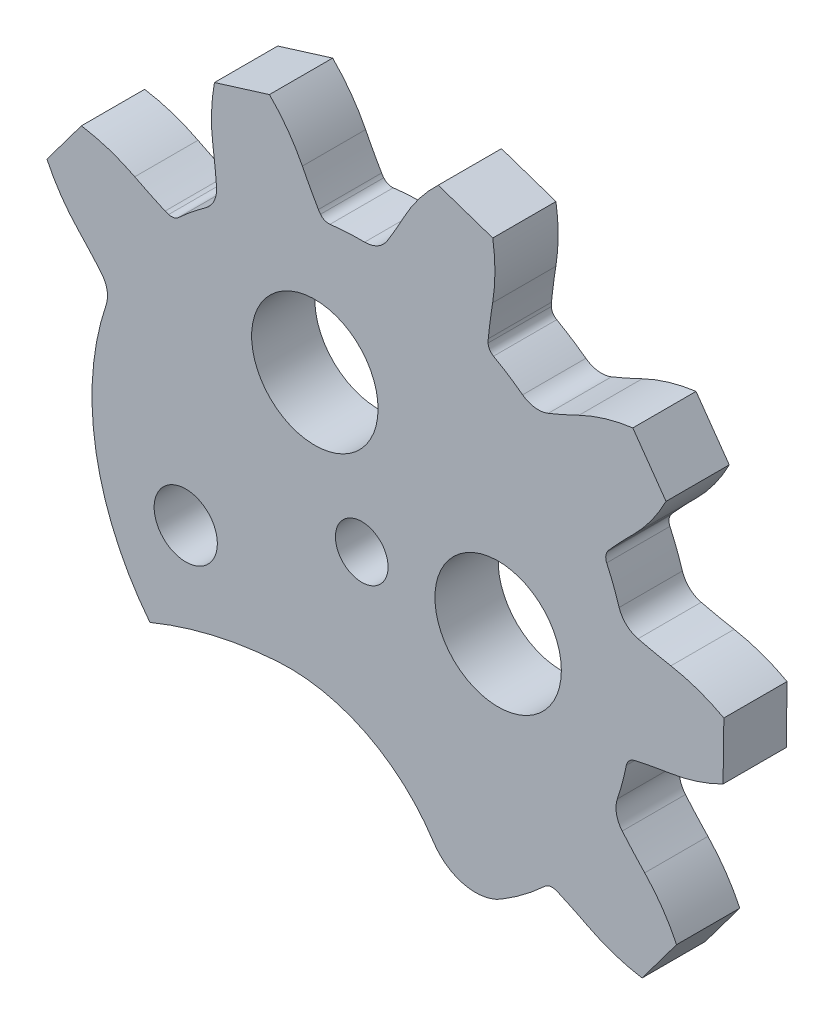
from build123d import *

# Parameters (mm, degrees)
ESQUISSE1_R        = 1.25
ESQUISSE1_R_2      = 3
ESQUISSE1_R_3      = 1.5
BOSS_EXTRU_1_DEPTH = 3


with BuildPart() as part:
    # Esquisse1 → Boss.-Extru.1 (new body)
    with BuildSketch(Plane.XY):
        with BuildLine():
            Line((1036.168665086, 2163.92668469), (1038.777951956, 2164.735581239))
            ThreePointArc((1038.777951956, 2164.735581239), (1039.645641159, 2163.718776789), (1040.340855862, 2162.577088409))
            ThreePointArc((1040.340855862, 2162.577088409), (1040.710583065, 2161.870292972), (1041.100970281, 2161.174695519))
            ThreePointArc((1041.100970281, 2161.174695519), (1041.148071574, 2161.099838925), (1041.200361208, 2161.028509858))
            ThreePointArc((1041.200361208, 2161.028509858), (1041.401673575, 2160.876243049), (1041.651712938, 2160.841715271))
            ThreePointArc((1041.651712938, 2160.841715271), (1042.472135802, 2160.912263521), (1043.295397124, 2160.929913601))
            ThreePointArc((1043.295397124, 2160.929913601), (1043.910230031, 2161.084508602), (1044.369546036, 2161.521484488))
            ThreePointArc((1044.369546036, 2161.521484488), (1044.778634779, 2162.206250429), (1045.167374464, 2162.902769957))
            ThreePointArc((1045.167374464, 2162.902769957), (1045.893264106, 2164.025204841), (1046.788181642, 2165.01812903))
            Line((1046.788181642, 2165.01812903), (1049.374596526, 2164.138839743))
            ThreePointArc((1049.374596526, 2164.138839743), (1049.478909177, 2162.806212746), (1049.370282093, 2161.473930495))
            ThreePointArc((1049.370282093, 2161.473930495), (1049.25395375, 2160.684800777), (1049.160921717, 2159.892586769))
            ThreePointArc((1049.160921717, 2159.892586769), (1049.155027862, 2159.804341066), (1049.155404891, 2159.715899564))
            ThreePointArc((1049.155404891, 2159.715899564), (1049.228769832, 2159.474384686), (1049.410761007, 2159.299481677))
            ThreePointArc((1049.410761007, 2159.299481677), (1050.115964268, 2158.874323951), (1050.792371125, 2158.404702301))
            ThreePointArc((1050.792371125, 2158.404702301), (1051.380650057, 2158.168382569), (1052.009092492, 2158.251924312))
            ThreePointArc((1052.009092492, 2158.251924312), (1052.742547559, 2158.565455267), (1053.466448477, 2158.900455947))
            ThreePointArc((1053.466448477, 2158.900455947), (1054.713456205, 2159.381857617), (1056.021085895, 2159.65913083))
            Line((1056.021085895, 2159.65913083), (1057.596706215, 2157.42751433))
            ThreePointArc((1057.596706215, 2157.42751433), (1056.897798427, 2156.288083004), (1056.026821411, 2155.274093419))
            ThreePointArc((1056.026821411, 2155.274093419), (1055.468870995, 2154.704050151), (1054.927954788, 2154.117818412))
            ThreePointArc((1054.927954788, 2154.117818412), (1054.871317037, 2154.04989046), (1054.819637448, 2153.97811817))
            ThreePointArc((1054.819637448, 2153.97811817), (1054.73703205, 2153.739605699), (1054.781460594, 2153.491134464))
            ThreePointArc((1054.781460594, 2153.491134464), (1055.102080574, 2152.732666561), (1055.373268538, 2151.955152691))
            ThreePointArc((1055.373268538, 2151.955152691), (1055.710290937, 2151.41818433), (1056.267816152, 2151.116381825))
            ThreePointArc((1056.267816152, 2151.116381825), (1057.045482637, 2150.938919624), (1057.828039241, 2150.784442585))
            ThreePointArc((1057.828039241, 2150.784442585), (1059.119850487, 2150.440931965), (1060.340722234, 2149.896645259))
            Line((1060.340722234, 2149.896645259), (1060.303714582, 2147.165103197))
            ThreePointArc((1060.303714582, 2147.165103197), (1059.068545375, 2146.654091582), (1057.767902043, 2146.34570422))
            ThreePointArc((1057.767902043, 2146.34570422), (1056.981447648, 2146.212484556), (1056.199258874, 2146.056155685))
            ThreePointArc((1056.199258874, 2146.056155685), (1056.113510922, 2146.034491652), (1056.029514563, 2146.006803149))
            ThreePointArc((1056.029514563, 2146.006803149), (1055.822491279, 2145.862396742), (1055.712386998, 2145.635264847))
            ThreePointArc((1055.712386998, 2145.635264847), (1055.525957764, 2144.833195728), (1055.288342248, 2144.044773508))
            ThreePointArc((1055.288342248, 2144.044773508), (1055.245377014, 2143.412260183), (1055.519029326, 2142.840391728))
            ThreePointArc((1055.519029326, 2142.840391728), (1056.043865064, 2142.239720901), (1056.58616733, 2141.65477112))
            ThreePointArc((1056.58616733, 2141.65477112), (1057.429354105, 2140.617557591), (1058.097136398, 2139.459609988))
            Line((1058.097136398, 2139.459609988), (1056.461636439, 2137.271498592))
            ThreePointArc((1056.461636439, 2137.271498592), (1055.161998468, 2137.584095755), (1053.928490366, 2138.099104107))
            ThreePointArc((1053.928490366, 2138.099104107), (1053.21393084, 2138.45359343), (1052.489239025, 2138.786879742))
            ThreePointArc((1052.489239025, 2138.786879742), (1052.407133676, 2138.819754553), (1052.3229043, 2138.846725905))
            ThreePointArc((1052.3229043, 2138.846725905), (1052.070538988, 2138.851583901), (1051.847957976, 2138.73254801))
            ThreePointArc((1051.847957976, 2138.73254801), (1050.855746376, 2137.899121153), (1049.782953643, 2137.172347506))
            ThreePointArc((1049.782953643, 2137.172347506), (1048.021944621, 2136.890714387), (1046.562157009, 2137.915160637))
            ThreePointArc((1046.562157009, 2137.915160637), (1043.357692527, 2140.785881782), (1039.138805682, 2141.628868317))
            ThreePointArc((1039.138805682, 2141.628868317), (1036.064607347, 2141.162614564), (1033.106023732, 2140.206125696))
            ThreePointArc((1033.106023732, 2140.206125696), (1030.545439739, 2145.948051891), (1031.027624755, 2152.216528933))
            ThreePointArc((1031.027624755, 2152.216528933), (1031.07058999, 2152.849042258), (1030.796937677, 2153.420910712))
            ThreePointArc((1030.796937677, 2153.420910712), (1030.27210194, 2154.02158154), (1029.729799674, 2154.606531321))
            ThreePointArc((1029.729799674, 2154.606531321), (1028.886612898, 2155.643744849), (1028.218830606, 2156.801692452))
            Line((1028.218830606, 2156.801692452), (1029.854330565, 2158.989803849))
            ThreePointArc((1029.854330565, 2158.989803849), (1031.153968536, 2158.677206686), (1032.387476638, 2158.162198333))
            ThreePointArc((1032.387476638, 2158.162198333), (1033.102036163, 2157.807709011), (1033.826727979, 2157.474422698))
            ThreePointArc((1033.826727979, 2157.474422698), (1033.908833328, 2157.441547887), (1033.993062704, 2157.414576536))
            ThreePointArc((1033.993062704, 2157.414576536), (1034.245428015, 2157.40971854), (1034.468009028, 2157.52875443))
            ThreePointArc((1034.468009028, 2157.52875443), (1035.090277846, 2158.068061624), (1035.74593579, 2158.566241703))
            ThreePointArc((1035.74593579, 2158.566241703), (1036.152477399, 2159.052701401), (1036.267223872, 2159.676201493))
            ThreePointArc((1036.267223872, 2159.676201493), (1036.195688295, 2160.470645106), (1036.1007814, 2161.262636695))
            ThreePointArc((1036.1007814, 2161.262636695), (1036.028287785, 2162.597372817), (1036.168665086, 2163.92668469))
        make_face()
        with Locations((1043.15798434, 2148.13065004)):
            Circle(ESQUISSE1_R, mode=Mode.SUBTRACT)
        with Locations((1040.931477639, 2154.395616576)):
            Circle(ESQUISSE1_R_2, mode=Mode.SUBTRACT)
        with Locations((1049.629972316, 2147.99435183)):
            Circle(ESQUISSE1_R_2, mode=Mode.SUBTRACT)
        with Locations((1034.806177599, 2145.042773361)):
            Circle(ESQUISSE1_R_3, mode=Mode.SUBTRACT)
    extrude(amount=BOSS_EXTRU_1_DEPTH)


solid = part.part
